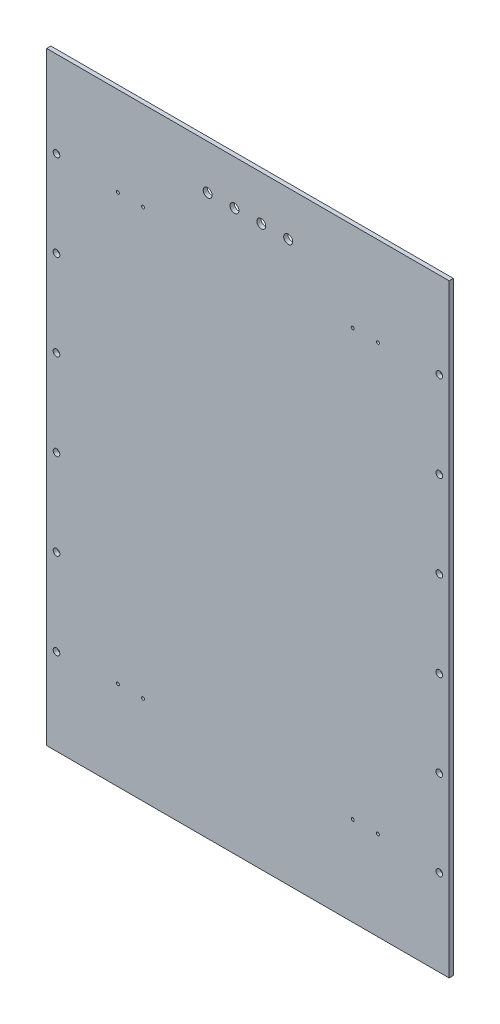
from build123d import *

# Parameters (mm, degrees)
SKETCH1_W               = 609.6
SKETCH1_H               = 914.4
BOSS_EXTRUDE1_DEPTH     = 3.175
F_8_CLEARANCE_HOLE1_D   = 4.4958
CUT_EXTRUDE1_DEPTH      = 550.522704263
CUT_EXTRUDE1_DEPTH_BACK = 550.522704263
SKETCH4_R               = 6.74624
F_3_8_CLEARANCE_HOLE1_D = 10.0838


with BuildPart() as part:
    # Sketch1 → Boss-Extrude1 (new, symmetric)
    with BuildSketch(Plane.XY):
        Rectangle(SKETCH1_W, SKETCH1_H)
    extrude(amount=BOSS_EXTRUDE1_DEPTH, both=True)

    # #8 Clearance Hole1 (through all)
    with Locations(Plane.XY.offset(3.175)):
        with Locations((-196.85, -322.2625), (-158.75, -322.2625), (196.85, -322.2625), (158.75, -322.2625), (158.75, 322.2625), (196.85, 322.2625), (-158.75, 322.2625), (-196.85, 322.2625)):
            Hole(F_8_CLEARANCE_HOLE1_D / 2)

    # Sketch4 → Cut-Extrude1 (cut, two sides: drawn at the far end of the back side and taken through both)
    with BuildSketch(Plane.XY.offset(3.175).offset(-CUT_EXTRUDE1_DEPTH_BACK)):
        with Locations((60.96, 389.892639343)):
            Circle(SKETCH4_R)
        with Locations((-20.32, 389.892639343)):
            Circle(SKETCH4_R)
        with Locations((20.32, 389.892639343)):
            Circle(SKETCH4_R)
        with Locations((-60.96, 389.892639343)):
            Circle(SKETCH4_R)
    extrude(amount=CUT_EXTRUDE1_DEPTH + CUT_EXTRUDE1_DEPTH_BACK, mode=Mode.SUBTRACT)

    # 3/8 Clearance Hole1 (through all)
    with Locations(Plane.XY.offset(3.175)):
        with Locations((-289.8775, -326.571428571), (-289.8775, -195.942857215), (-289.8775, -65.314285859), (-289.8775, 65.314285497), (-289.8775, 195.942856853), (-289.8775, 326.571428209), (289.8775, 326.571428209), (289.8775, 195.942856853), (289.8775, 65.314285497), (289.8775, -65.314285859), (289.8775, -195.942857215), (289.8775, -326.571428571)):
            Hole(F_3_8_CLEARANCE_HOLE1_D / 2)


solid = part.part
